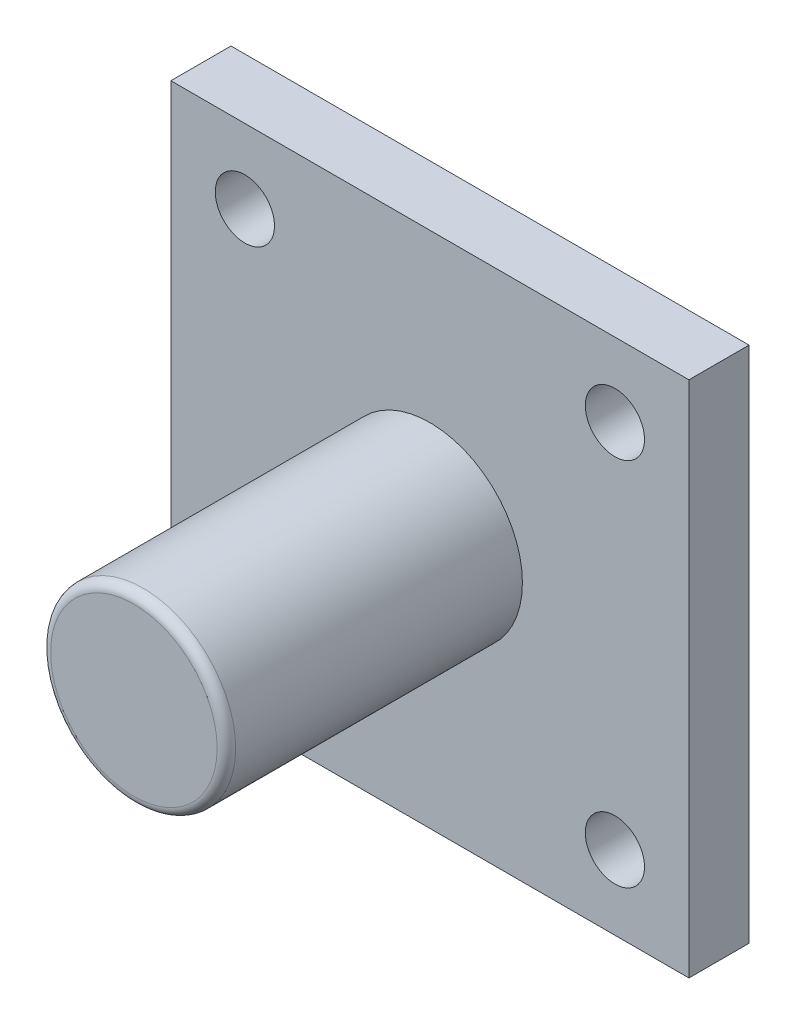
from build123d import *

# Parameters (mm, degrees)
SKETCH1_W           = 28
SKETCH1_H           = 28
BOSS_EXTRUDE1_DEPTH = 3.25
SKETCH2_R           = 5
BOSS_EXTRUDE2_DEPTH = 16
SKETCH3_R           = 1.6
CUT_EXTRUDE1_DEPTH  = 45.029109689
FILLET1_R           = 0.5
SKETCH4_W           = 13
SKETCH4_H           = 2.5
SKETCH4_W_2         = 2.5
SKETCH4_H_2         = 13
BOSS_EXTRUDE3_DEPTH = 0.5


with BuildPart() as part:
    # Sketch1 → Boss-Extrude1 (new body)
    with BuildSketch(Plane.XY):
        with Locations((14, 14)):
            Rectangle(SKETCH1_W, SKETCH1_H)
    extrude(amount=BOSS_EXTRUDE1_DEPTH)

    # Sketch2 → Boss-Extrude2 (add)
    with BuildSketch(Plane.XY.offset(3.25)):
        with Locations((14, 14)):
            Circle(SKETCH2_R)
    extrude(amount=BOSS_EXTRUDE2_DEPTH)

    # Sketch3 → Cut-Extrude1 (cut, through all)
    with BuildSketch(Plane(origin=(0, 0, 0), x_dir=(-1, 0, 0), z_dir=(0, 0, -1))):
        with Locations((-24, 24)):
            Circle(SKETCH3_R)
        with Locations((-4, 24)):
            Circle(SKETCH3_R)
        with Locations((-4, 4)):
            Circle(SKETCH3_R)
        with Locations((-24, 4)):
            Circle(SKETCH3_R)
    extrude(amount=-CUT_EXTRUDE1_DEPTH, mode=Mode.SUBTRACT)

    # Fillet1
    fillet1_edges = [part.edges().sort_by_distance(p)[0] for p in [
        (9, 14, 19.25),
    ]]
    fillet(fillet1_edges, radius=FILLET1_R)

    # Sketch4 → Boss-Extrude3 (add)
    with BuildSketch(Plane(origin=(0, 0, 0), x_dir=(-1, 0, 0), z_dir=(0, 0, -1))):
        with Locations((-14, 24.25)):
            Rectangle(SKETCH4_W, SKETCH4_H)
        with Locations((-3.75, 14)):
            Rectangle(SKETCH4_W_2, SKETCH4_H_2)
        with Locations((-14, 3.75)):
            Rectangle(SKETCH4_W, SKETCH4_H)
        with Locations((-24.25, 14)):
            Rectangle(SKETCH4_W_2, SKETCH4_H_2)
    extrude(amount=BOSS_EXTRUDE3_DEPTH)


solid = part.part
